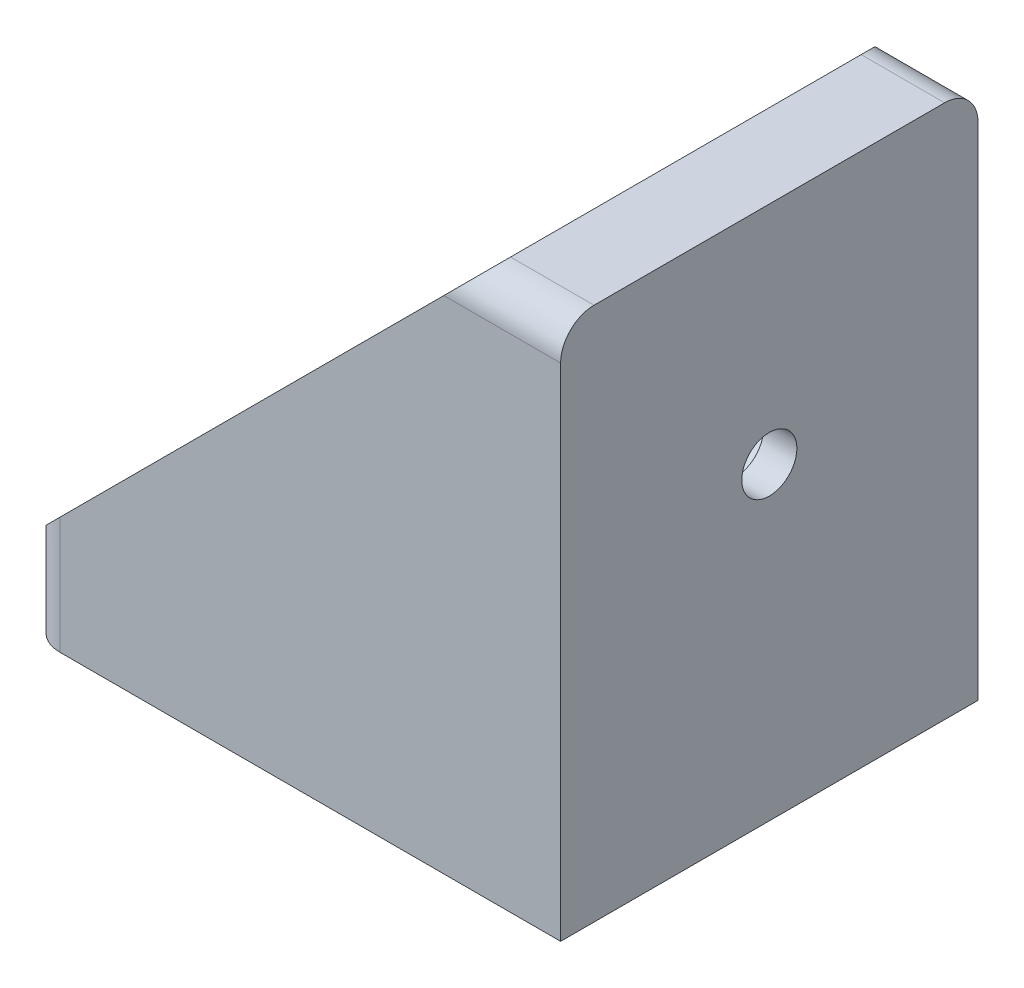
from build123d import *

# Parameters (mm, degrees)
EXTRUDE_1_DEPTH     = 25
RIB_1_REACH         = 53.701
SKETCH_3_WALL_W     = 143.585893822
SKETCH_3_WALL_H     = 3
FILLET_1_R          = 2
CUT_EXTRUDE_1_DEPTH = 3
CUT_EXTRUDE_2_DEPTH = 3
SKETCH_7_R          = 1.65
CUT_EXTRUDE_3_DEPTH = 11
SKETCH_6_R          = 1.65
CUT_EXTRUDE_4_DEPTH = 11


with BuildPart() as part:
    # Эскиз1 → Бобышка-Вытянуть1 (new body)
    with BuildSketch(Plane.XY):
        Polygon((0, 0), (-32, 0), (-32, 5), (-5, 5), (-5, 32), (0, 32), align=None)
    extrude(amount=EXTRUDE_1_DEPTH)

    # Эскиз3 wall → Ребро1 (add, up to next)
    with BuildSketch(Plane(origin=(-18.5, 18.5, 25), x_dir=(0.707106781187, 0.707106781187, 0), z_dir=(-0.707106781187, 0.707106781187, 0)), mode=Mode.PRIVATE) as rib_1_sk1:
        with Locations((0, 1.5)):
            Rectangle(SKETCH_3_WALL_W, SKETCH_3_WALL_H)
    rib_1_tool1 = extrude(rib_1_sk1.sketch, amount=-RIB_1_REACH, mode=Mode.PRIVATE) - part.part
    rib_1 = rib_1_tool1.solids().sort_by_distance((-18.5, 18.5, 25))[0]
    add(rib_1)

    # Зеркальное отражение1: Ребро1 across plane
    add(rib_1.mirror(Plane.XY.offset(12.5)))

    # Скругление1
    fillet_1_edges = [part.edges().sort_by_distance(p)[0] for p in [
        (-32, 2.5, 25),
        (-32, 2.5, 0),
        (-2.5, 32, 0),
        (-2.5, 32, 25),
    ]]
    fillet(fillet_1_edges, radius=FILLET_1_R)

    # Эскиз4 → Вырез-Вытянуть1 (cut)
    with BuildSketch(Plane(origin=(0, 5, 0), x_dir=(1, 0, 0), z_dir=(0, 1, 0))):
        Polygon((-15.035898385, -12.5), (-16.767949192, -9.5), (-20.232050808, -9.5), (-21.964101615, -12.5), (-20.232050808, -15.5), (-16.767949192, -15.5), align=None)
    extrude(amount=-CUT_EXTRUDE_1_DEPTH, mode=Mode.SUBTRACT)

    # Эскиз5 → Вырез-Вытянуть2 (cut)
    with BuildSketch(Plane.ZY.offset(5)):
        Polygon((12.5, 15.035898385), (15.5, 16.767949192), (15.5, 20.232050808), (12.5, 21.964101615), (9.5, 20.232050808), (9.5, 16.767949192), align=None)
    extrude(amount=-CUT_EXTRUDE_2_DEPTH, mode=Mode.SUBTRACT)

    # Эскиз7 → Вырез-Вытянуть3 (cut)
    with BuildSketch(Plane.ZY.offset(2)):
        with Locations((12.5, 18.5)):
            Circle(SKETCH_7_R)
    extrude(amount=-CUT_EXTRUDE_3_DEPTH, mode=Mode.SUBTRACT)

    # Эскиз6 → Вырез-Вытянуть4 (cut)
    with BuildSketch(Plane(origin=(0, 2, 0), x_dir=(1, 0, 0), z_dir=(0, 1, 0))):
        with Locations(Location((-18.5, -12.5, 0), (0, 0, 270))):
            Circle(SKETCH_6_R)
    extrude(amount=-CUT_EXTRUDE_4_DEPTH, mode=Mode.SUBTRACT)


solid = part.part
